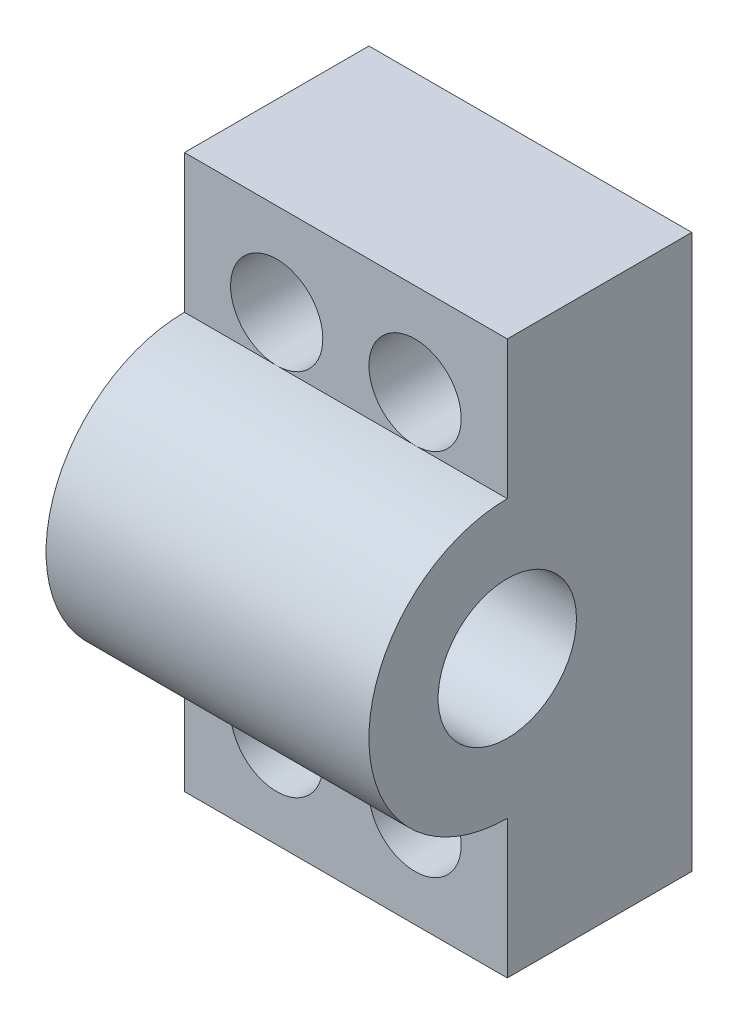
from build123d import *

# Parameters (mm, degrees)
BODY_DEPTH         = 35
SKETCH2_R          = 5
FIXING_HOLES_DEPTH = 58.879184514
SKETCH3_R          = 7.5
SHAFT_HOLE_DEPTH   = 40


with BuildPart() as part:
    # Sketch1 → body (new body)
    with BuildSketch(Plane(origin=(0, 0, 0), x_dir=(0, 0, -1), z_dir=(1, 0, 0))):
        with BuildLine():
            Line((0, -30), (0, 30))
            Line((0, 30), (-20, 30))
            Line((-20, 30), (-20, 15))
            ThreePointArc((-20, 15), (-35, 0), (-20, -15))
            Line((-20, -15), (-20, -30))
            Line((-20, -30), (0, -30))
        make_face()
    extrude(amount=BODY_DEPTH)

    # Sketch2 → fixing holes (cut, through all)
    with BuildSketch(Plane.XY):
        with Locations(Location((10, 20, 0), (0, 0, 270))):
            Circle(SKETCH2_R)
        with Locations(Location((25, 20, 0), (0, 0, 270))):
            Circle(SKETCH2_R)
        with Locations(Location((10, -20, 0), (0, 0, 90))):
            Circle(SKETCH2_R)
        with Locations(Location((25, -20, 0), (0, 0, 90))):
            Circle(SKETCH2_R)
    extrude(amount=FIXING_HOLES_DEPTH, mode=Mode.SUBTRACT)

    # Sketch3 → shaft hole (cut)
    with BuildSketch(Plane(origin=(35, 0, 0), x_dir=(0, 0, -1), z_dir=(1, 0, 0))):
        with Locations((-20, 0)):
            Circle(SKETCH3_R)
    extrude(amount=-SHAFT_HOLE_DEPTH, mode=Mode.SUBTRACT)


solid = part.part
